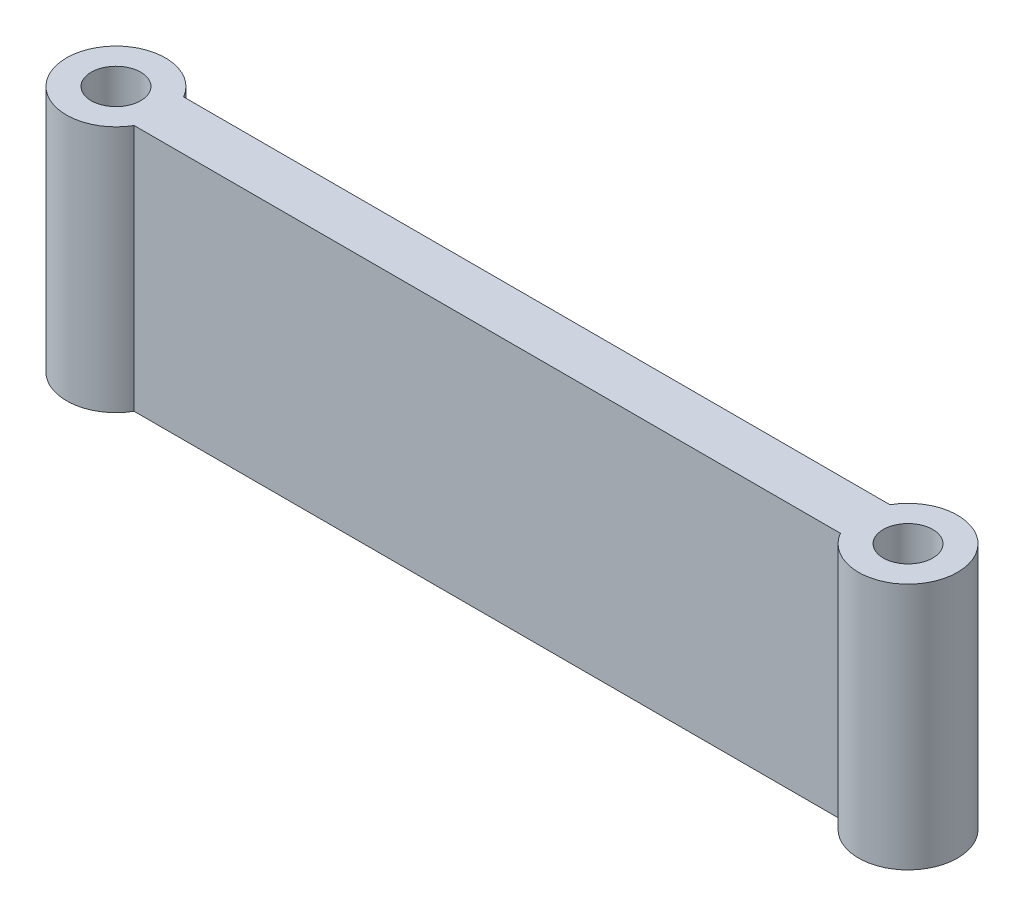
from build123d import *

# Parameters (mm, degrees)
SKETCH1_R           = 2.5
BOSS_EXTRUDE1_DEPTH = 12.5


with BuildPart() as part:
    # Sketch1 → Boss-Extrude1 (new, symmetric)
    with BuildSketch(Plane(origin=(0, 0, 0), x_dir=(1, 0, 0), z_dir=(0, 1, 0))):
        with BuildLine():
            Line((4.330127019, -2.5), (75.669872981, -2.5))
            ThreePointArc((75.669872981, -2.5), (85, 0), (75.669872981, 2.5))
            Line((75.669872981, 2.5), (4.330127019, 2.5))
            ThreePointArc((4.330127019, 2.5), (-5, 0), (4.330127019, -2.5))
        make_face()
        with Locations(Location((0, 0, 0), (0, 0, 270))):
            Circle(SKETCH1_R, mode=Mode.SUBTRACT)
        with Locations(Location((80, 0, 0), (0, 0, 270))):
            Circle(SKETCH1_R, mode=Mode.SUBTRACT)
    extrude(amount=BOSS_EXTRUDE1_DEPTH, both=True)


solid = part.part
